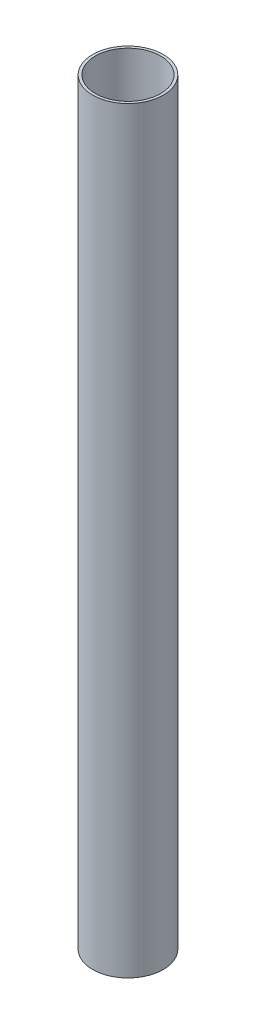
from build123d import *

# Parameters (mm, degrees)
SKETCH1_R   = 34.29
SKETCH1_R_2 = 31.75


with BuildPart() as part:
    # Sweep1: sweep along a curve in space
    with BuildLine() as sweep1_path:
        Line((0, 0, 0), (0, 736.6, 0))
    # Sketch1 → Sweep1 (sweep)
    with BuildSketch(Plane(origin=(0, 0, 0), x_dir=(1, 0, 0), z_dir=(0, 1, 0))):
        Circle(SKETCH1_R)
        Circle(SKETCH1_R_2, mode=Mode.SUBTRACT)
    sweep(path=sweep1_path.line)


solid = part.part
